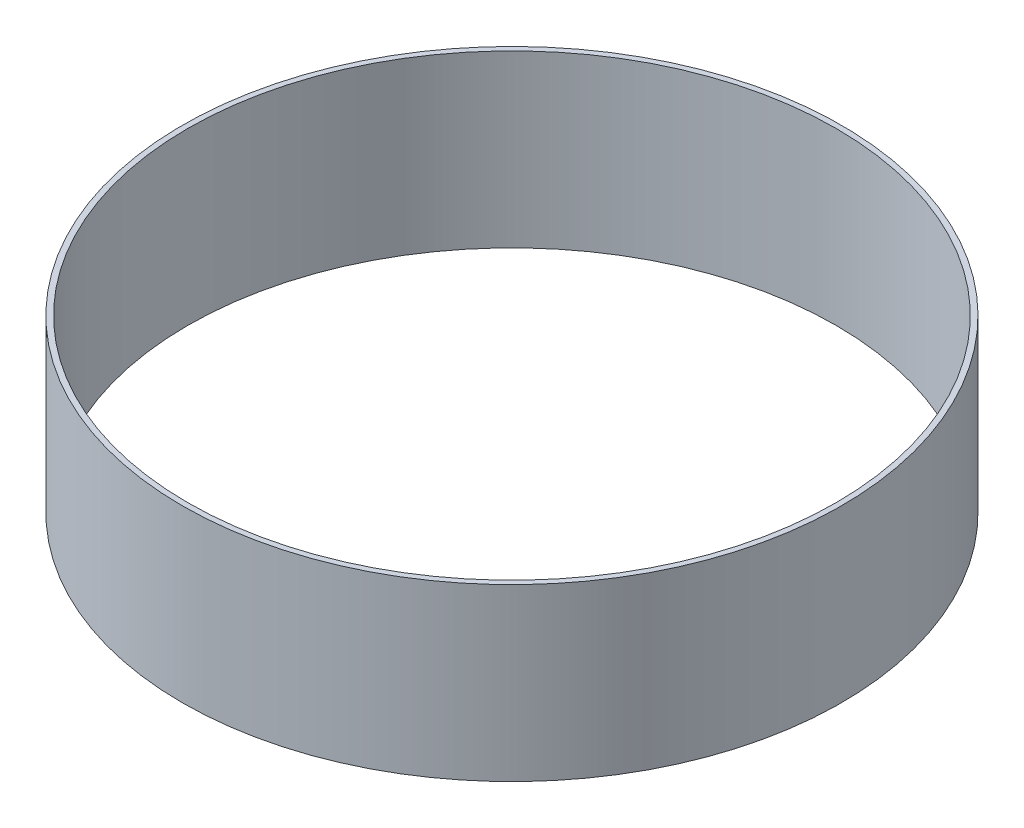
from build123d import *

# Parameters (mm, degrees)
SKETCH1_R           = 21.25
SKETCH1_R_2         = 20.9
BOSS_EXTRUDE1_DEPTH = 11


with BuildPart() as part:
    # Sketch1 → Boss-Extrude1 (new body)
    with BuildSketch(Plane(origin=(0, 0, 0), x_dir=(1, 0, 0), z_dir=(0, 1, 0))):
        with Locations(Location((0, 0, 0), (0, 0, 270))):
            Circle(SKETCH1_R)
        with Locations(Location((0, 0, 0), (0, 0, 270))):
            Circle(SKETCH1_R_2, mode=Mode.SUBTRACT)
    extrude(amount=BOSS_EXTRUDE1_DEPTH)


solid = part.part
